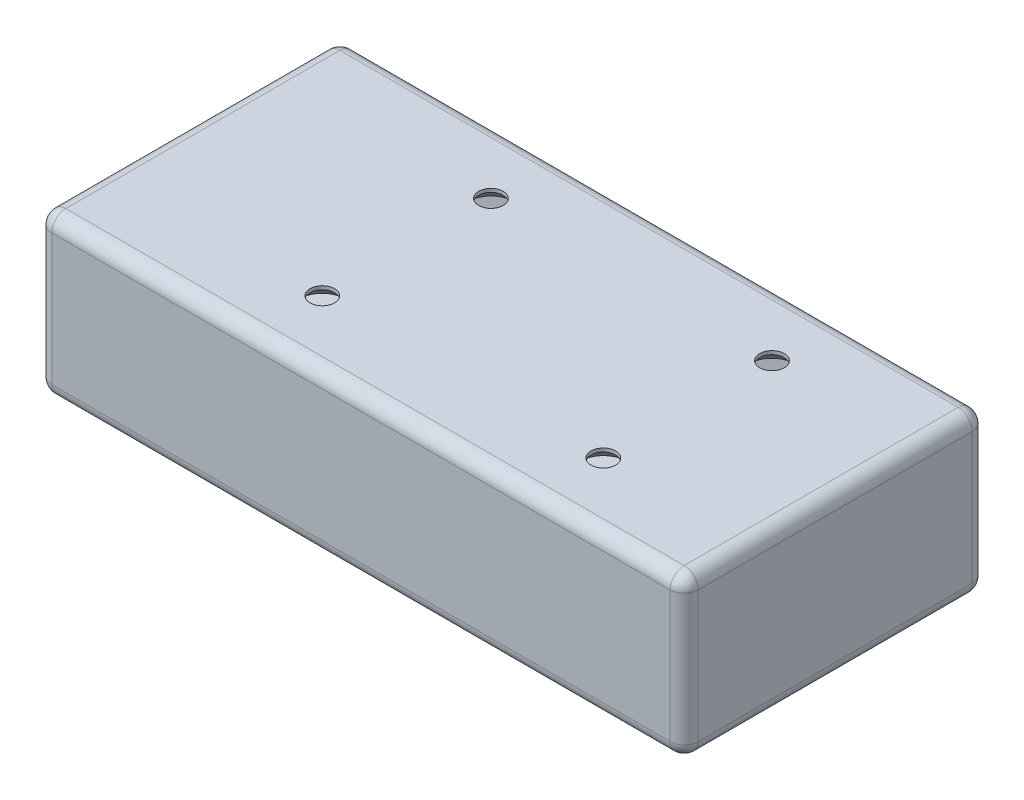
from build123d import *

# Parameters (mm, degrees)
SKETCH1_W           = 92
SKETCH1_H           = 43
BOSS_EXTRUDE1_DEPTH = 22.7
SHELL1_T            = 2
FILLET1_R           = 2
SKETCH2_R           = 1.75
CUT_EXTRUDE1_DEPTH  = 10
SKETCH3_R           = 2
CUT_EXTRUDE2_DEPTH  = 1
SKETCH6_W           = 8
SKETCH6_H           = 5
CUT_EXTRUDE3_DEPTH  = 1
SKETCH7_W           = 3.085341893
SKETCH7_H           = 1.807128823
BOSS_EXTRUDE2_DEPTH = 4
CHAMFER1_SIZE       = 1.5


with BuildPart() as part:
    # Sketch1 → Boss-Extrude1 (new body)
    with BuildSketch(Plane(origin=(0, 0, 0), x_dir=(1, 0, 0), z_dir=(0, 1, 0))):
        Rectangle(SKETCH1_W, SKETCH1_H)
    extrude(amount=BOSS_EXTRUDE1_DEPTH)

    # Shell1 (no face opened: a closed hollow body)
    add(offset(amount=-SHELL1_T, mode=Mode.PRIVATE), mode=Mode.SUBTRACT)

    # Fillet1
    fillet1_edges = [part.edges().sort_by_distance(p)[0] for p in [
        (46, 22.7, 0),
        (0, 22.7, -21.5),
        (-46, 22.7, 0),
        (0, 0, -21.5),
        (46, 0, 0),
        (0, 0, 21.5),
        (-46, 0, 0),
        (-46, 11.35, -21.5),
        (46, 11.35, -21.5),
        (46, 11.35, 21.5),
        (-46, 11.35, 21.5),
        (0, 22.7, 21.5),
    ]]
    fillet(fillet1_edges, radius=FILLET1_R)

    # Sketch2 → Cut-Extrude1 (cut)
    with BuildSketch(Plane(origin=(0, 22.7, 0), x_dir=(1, 0, 0), z_dir=(0, 1, 0))):
        with Locations(Location((-15, 12, 0), (0, 0, 270))):
            Circle(SKETCH2_R)
        with Locations(Location((-15, -12, 0), (0, 0, 270))):
            Circle(SKETCH2_R)
        with Locations(Location((25, -12, 0), (0, 0, 270))):
            Circle(SKETCH2_R)
        with Locations(Location((25, 12, 0), (0, 0, 270))):
            Circle(SKETCH2_R)
    extrude(amount=-CUT_EXTRUDE1_DEPTH, mode=Mode.SUBTRACT)

    # Sketch3 → Cut-Extrude2 (cut)
    with BuildSketch(Plane.ZY.offset(46)):
        with Locations((15.5, 17.7)):
            Circle(SKETCH3_R)
    extrude(amount=-CUT_EXTRUDE2_DEPTH, mode=Mode.SUBTRACT)

    # Sketch6 → Cut-Extrude3 (cut)
    with BuildSketch(Plane.ZY.offset(46)):
        with Locations((-8.5, 10.2)):
            Rectangle(SKETCH6_W, SKETCH6_H)
    extrude(amount=-CUT_EXTRUDE3_DEPTH, mode=Mode.SUBTRACT)

    # Sketch7 → Boss-Extrude2 (add)
    with BuildSketch(Plane.ZY.offset(45)):
        with Locations((-9.829017748, 10.046015555)):
            Rectangle(SKETCH7_W, SKETCH7_H)
    extrude(amount=BOSS_EXTRUDE2_DEPTH)

    # Chamfer1
    chamfer1_edges = [part.edges().sort_by_distance(p)[0] for p in [
        (25, 20.7, -13.75),
        (25, 20.7, 10.25),
        (-15, 20.7, 10.25),
        (-15, 20.7, -13.75),
    ]]
    chamfer(chamfer1_edges, length=CHAMFER1_SIZE)


solid = part.part
